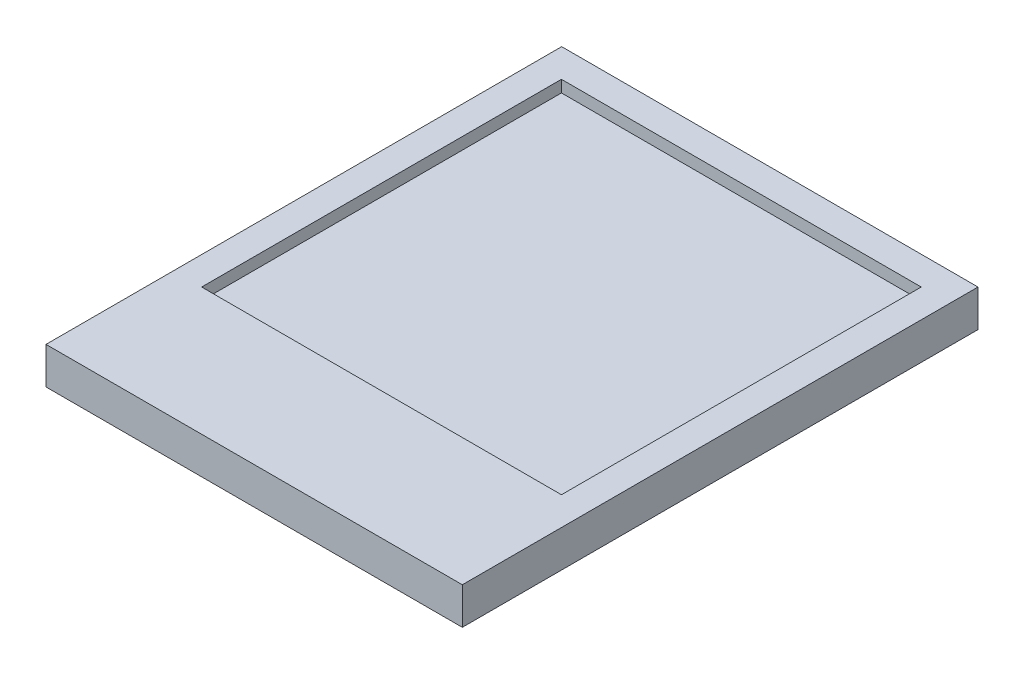
from build123d import *

# Parameters (mm, degrees)
SKETCH_1_W          = 17.6
SKETCH_1_H          = 21.8
EXTRUDE_1_DEPTH     = 1.56
SKETCH_2_W          = 15.21
SKETCH_2_H          = 15.21
CUT_EXTRUDE_1_DEPTH = 0.5


with BuildPart() as part:
    # 草图1 → 凸台-拉伸1 (new body)
    with BuildSketch(Plane(origin=(0, 0, 0), x_dir=(1, 0, 0), z_dir=(0, 1, 0))):
        with Locations((0.972375691, -4.190607735)):
            Rectangle(SKETCH_1_W, SKETCH_1_H)
    extrude(amount=EXTRUDE_1_DEPTH)

    # 草图2 → 切除-拉伸1 (cut)
    with BuildSketch(Plane(origin=(0, 1.56, 0), x_dir=(1, 0, 0), z_dir=(0, 1, 0))):
        with Locations((0.967375691, -2.095607735)):
            Rectangle(SKETCH_2_W, SKETCH_2_H)
    extrude(amount=-CUT_EXTRUDE_1_DEPTH, mode=Mode.SUBTRACT)


solid = part.part
